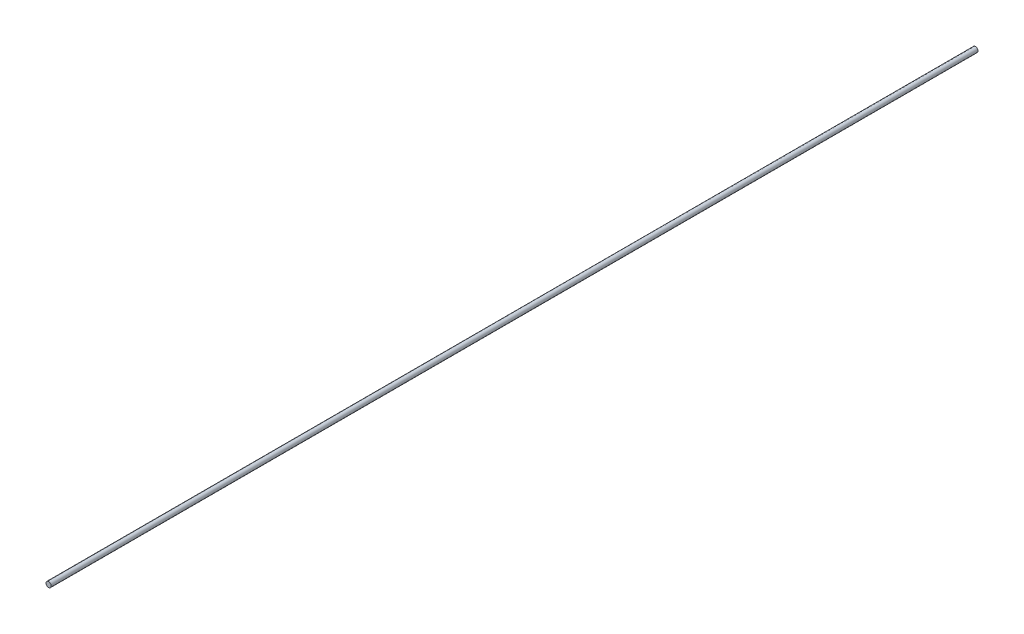
from build123d import *

# Parameters (mm, degrees)
ESBO_O1_R                = 5
RESSALTO_EXTRUS_O1_DEPTH = 1800


with BuildPart() as part:
    # Esboço1 → Ressalto-extrusão1 (new body)
    with BuildSketch(Plane.XY):
        Circle(ESBO_O1_R)
    extrude(amount=RESSALTO_EXTRUS_O1_DEPTH)


solid = part.part
